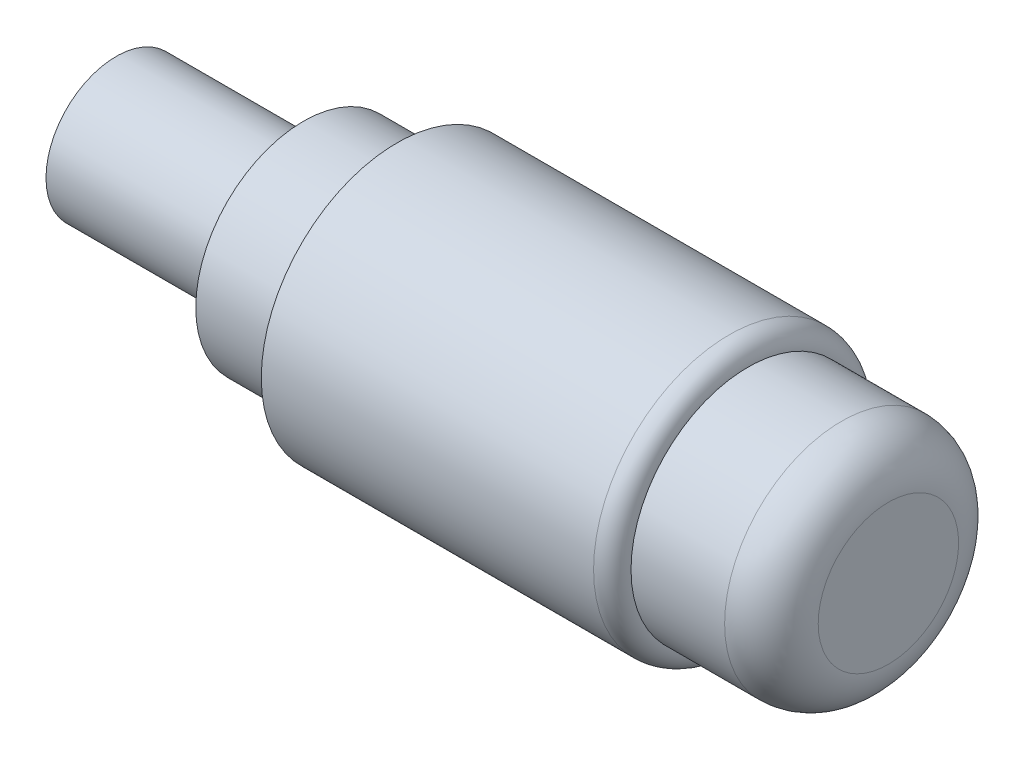
from build123d import *


with BuildPart() as part:
    # 草图1 → 旋转1 (revolve)
    with BuildSketch(Plane.XY, mode=Mode.PRIVATE) as revolve_1_sk:
        with BuildLine():
            Line((0, 0), (0, 1.5))
            Line((0, 1.5), (4, 1.5))
            Line((4, 1.5), (4, 2.3))
            Line((4, 2.3), (6, 2.3))
            Line((6, 2.3), (6, 2.9))
            Line((6, 2.9), (13.1, 2.9))
            ThreePointArc((13.1, 2.9), (13.382842712, 2.782842712), (13.5, 2.5))
            Line((13.5, 2.5), (15.5, 2.5))
            ThreePointArc((15.5, 2.5), (16.207106781, 2.207106781), (16.5, 1.5))
            Line((16.5, 1.5), (16.5, 0))
            Line((16.5, 0), (0, 0))
        make_face()
    revolve(revolve_1_sk.sketch.rotate(Axis((-9.404400031, 0, 0), (1, 0, 0)), 90), axis=Axis((-9.404400031, 0, 0), (1, 0, 0)))


solid = part.part
